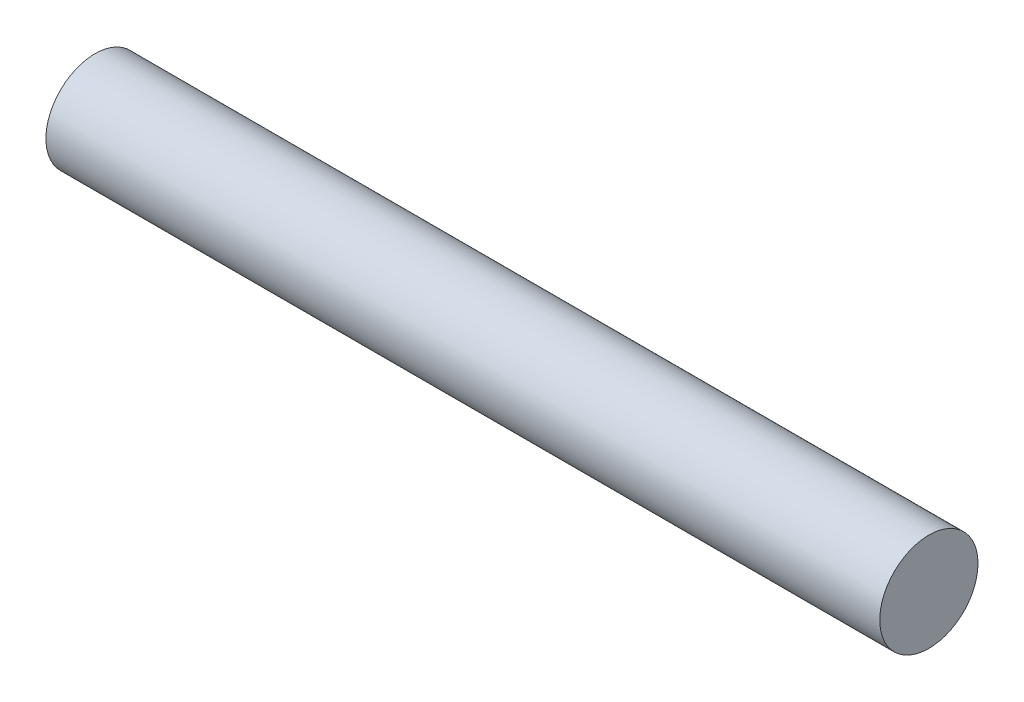
from build123d import *

# Parameters (mm, degrees)
SKETCH1_R           = 4
BOSS_EXTRUDE1_DEPTH = 67.9


with BuildPart() as part:
    # Sketch1 → Boss-Extrude1 (new body)
    with BuildSketch(Plane(origin=(0, 0, 0), x_dir=(0, 0, -1), z_dir=(1, 0, 0))):
        Circle(SKETCH1_R)
    extrude(amount=BOSS_EXTRUDE1_DEPTH)


solid = part.part
